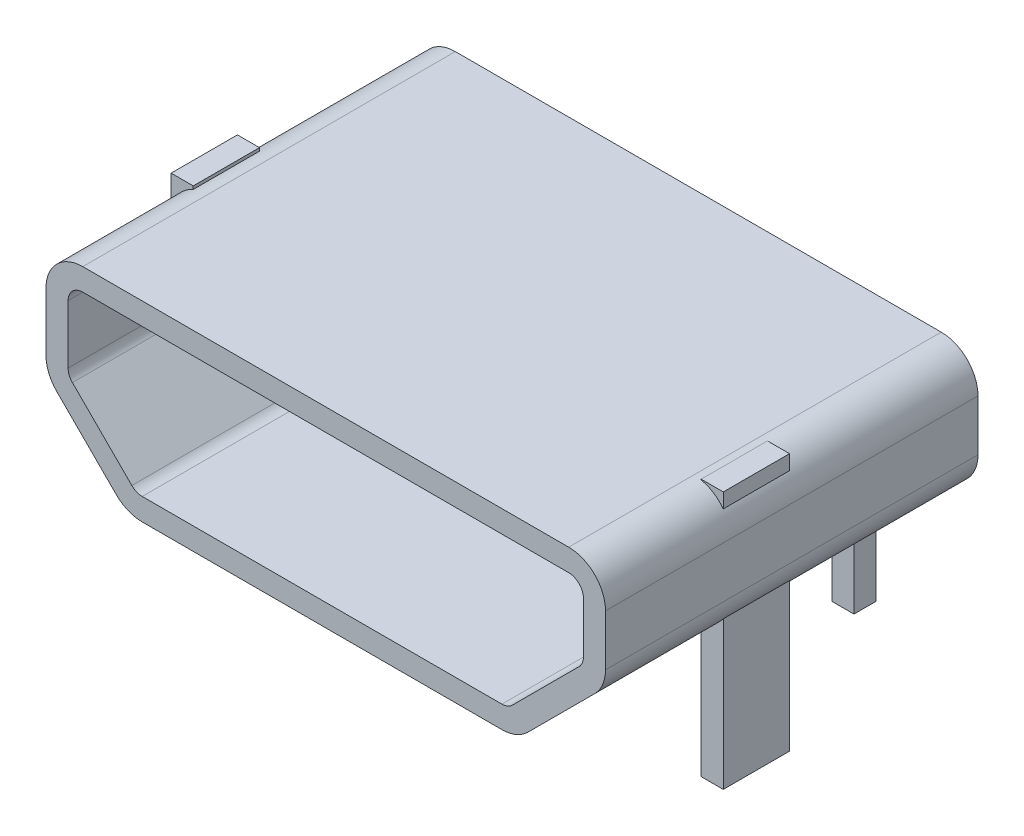
from build123d import *

# Parameters (mm, degrees)
EXTRUDE_1_DEPTH     = 5.06
CUT_EXTRUDE_1_REACH = 8.869
SKETCH_2_W          = 0.3
SKETCH_2_H          = 0.3
SKETCH_2_H_2        = 0.9
EXTRUDE_2_DEPTH     = 3.5


with BuildPart() as part:
    # 草图1 → 凸台-拉伸1 (new body)
    with BuildSketch(Plane.XY):
        with BuildLine():
            Line((-3.603553391, 0.953553391), (-2.796446609, 0.146446609))
            ThreePointArc((-2.796446609, 0.146446609), (-2.634234935, 0.038060234), (-2.442893219, 0))
            Line((-2.442893219, 0), (2.442893219, 0))
            ThreePointArc((2.442893219, 0), (2.634234935, 0.038060234), (2.796446609, 0.146446609))
            Line((2.796446609, 0.146446609), (3.703553391, 1.053553391))
            ThreePointArc((3.703553391, 1.053553391), (3.811939766, 1.215765065), (3.85, 1.407106781))
            Line((3.85, 1.407106781), (3.85, 2.1))
            ThreePointArc((3.85, 2.1), (3.703553391, 2.453553391), (3.35, 2.6))
            Line((3.35, 2.6), (-3.25, 2.6))
            ThreePointArc((-3.25, 2.6), (-3.603553391, 2.453553391), (-3.75, 2.1))
            Line((-3.75, 2.1), (-3.75, 1.307106781))
            ThreePointArc((-3.75, 1.307106781), (-3.711939766, 1.115765065), (-3.603553391, 0.953553391))
        make_face()
    extrude(amount=EXTRUDE_1_DEPTH)

    # 草图4 → 切除-拉伸1 (cut, up to next)
    with BuildSketch(Plane(origin=(0, 0, 0), x_dir=(-1, 0, 0), z_dir=(0, 0, -1)), mode=Mode.PRIVATE) as cut_extrude_1_sk1:
        with BuildLine():
            Line((-2.442893219, 0.3), (2.442893219, 0.3))
            ThreePointArc((2.442893219, 0.3), (2.519429905, 0.315224093), (2.584314575, 0.358578644))
            Line((2.584314575, 0.358578644), (3.391421356, 1.165685425))
            ThreePointArc((3.391421356, 1.165685425), (3.434775907, 1.230570095), (3.45, 1.307106781))
            Line((3.45, 1.307106781), (3.45, 2.1))
            ThreePointArc((3.45, 2.1), (3.391421356, 2.241421356), (3.25, 2.3))
            Line((3.25, 2.3), (-3.35, 2.3))
            ThreePointArc((-3.35, 2.3), (-3.491421356, 2.241421356), (-3.55, 2.1))
            Line((-3.55, 2.1), (-3.55, 1.407106781))
            ThreePointArc((-3.55, 1.407106781), (-3.534775907, 1.330570095), (-3.491421356, 1.265685425))
            Line((-3.491421356, 1.265685425), (-2.584314575, 0.358578644))
            ThreePointArc((-2.584314575, 0.358578644), (-2.519429905, 0.315224093), (-2.442893219, 0.3))
        make_face()
    cut_extrude_1_tool1 = extrude(cut_extrude_1_sk1.sketch, amount=-CUT_EXTRUDE_1_REACH, mode=Mode.PRIVATE) & part.part
    add(cut_extrude_1_tool1.solids().sort_by_distance((0.027478, 1.348077, 0))[0], mode=Mode.SUBTRACT)

    # 草图2 → 凸台-拉伸2 (add)
    with BuildSketch(Plane(origin=(0, 2.6, 0), x_dir=(1, 0, 0), z_dir=(0, 1, 0))):
        with Locations((-2.425, -0.26)):
            Rectangle(SKETCH_2_W, SKETCH_2_H)
        with Locations((-3.6, -2.91)):
            Rectangle(SKETCH_2_W, SKETCH_2_H_2)
        with Locations((3.6, -2.91)):
            Rectangle(SKETCH_2_W, SKETCH_2_H_2)
        with Locations((2.425, -0.26)):
            Rectangle(SKETCH_2_W, SKETCH_2_H)
    extrude(amount=-EXTRUDE_2_DEPTH)


solid = part.part
